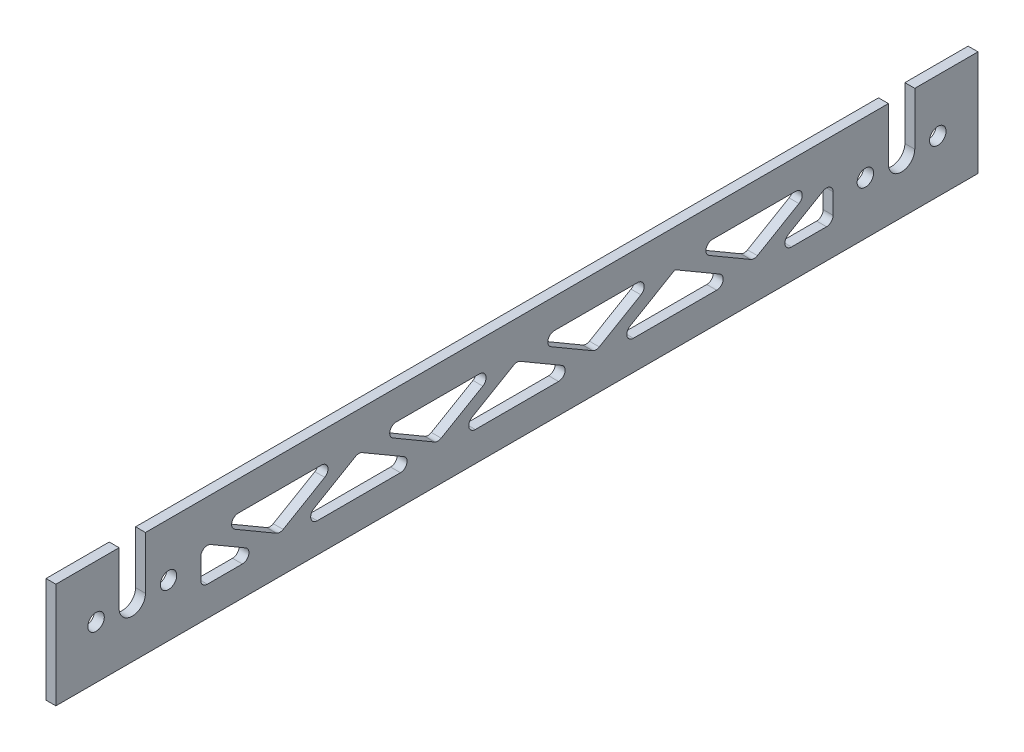
from build123d import *

# Parameters (mm, degrees)
SKETCH1_R           = 1.05
BOSS_EXTRUDE1_DEPTH = 1.5
FILLET1_R           = 1.5
SKETCH2_R           = 1.05
SKETCH2_W           = 4
SKETCH2_H           = 16
BOSS_EXTRUDE2_DEPTH = 1.5
SKETCH4_R           = 1.25
CUT_EXTRUDE2_DEPTH  = 160.067595694
CUT_EXTRUDE4_DEPTH  = 160.067595694
FILLET3_R           = 1
FILLET4_R           = 1.5
SKETCH6_W           = 140
SKETCH6_H           = 59.5
CUT_EXTRUDE5_DEPTH  = 10


with BuildPart() as part:
    # Sketch1 → Boss-Extrude1 (new body)
    with BuildSketch(Plane(origin=(0, 0, 0), x_dir=(0, 0, -1), z_dir=(1, 0, 0))):
        Polygon((0, 0), (0, 75.5), (21.5, 75.5), (40, 0), (35.881667859, 0), (29.755840045, 25), (4, 25), (4, 0), align=None)
        with Locations((5.5, 72.5)):
            Circle(SKETCH1_R, mode=Mode.SUBTRACT)
        with Locations((18.5, 72.5)):
            Circle(SKETCH1_R, mode=Mode.SUBTRACT)
        Polygon((4, 69.5), (18.851866535, 69.5), (4, 29), align=None, mode=Mode.SUBTRACT)
        Polygon((8.260475549, 29), (20.558388216, 62.535546651), (28.775707595, 29), align=None, mode=Mode.SUBTRACT)
    extrude(amount=BOSS_EXTRUDE1_DEPTH)

    # Fillet1
    fillet1_edges = [part.edges().sort_by_distance(p)[0] for p in [
        (0.75, 75.5, -21.5),
        (0.75, 25, -29.755840045),
        (0.75, 25, -4),
        (0.75, 69.5, -4),
        (0.75, 29, -4),
        (0.75, 69.5, -18.851866535),
        (0.75, 29, -8.260475549),
        (0.75, 29, -28.775707595),
        (0.75, 62.535546651, -20.558388216),
    ]]
    fillet(fillet1_edges, radius=FILLET1_R)

    # Sketch2 → Boss-Extrude2 (add)
    # profile 1 of 5: a face of its own
    with BuildSketch(Plane(origin=(1.5, 0, 0), x_dir=(0, 0, -1), z_dir=(1, 0, 0))):
        Polygon((70, 0), (70, 16), (36.079470199, 16), (40, 0), align=None)
    # profile 2 of 5: a face of its own
    with BuildSketch(Plane(origin=(1.5, 0, 0), x_dir=(0, 0, -1), z_dir=(1, 0, 0))):
        with BuildLine():
            Line((103.920529801, 16), (70, 16))
            Line((70, 16), (70, 0))
            Line((70, 0), (140, 0))
            Line((140, 0), (140, 16))
            Line((140, 16), (140, 75.5))
            Line((140, 75.5), (119.676824884, 75.5))
            ThreePointArc((119.676824884, 75.5), (118.750942408, 75.180144754), (118.219924421, 74.356988855))
            Line((118.219924421, 74.356988855), (103.920529801, 16))
        make_face()
        with BuildLine():
            Line((108.038861942, 16), (109.964084377, 23.856988855))
            ThreePointArc((109.964084377, 23.856988855), (110.495102363, 24.680144754), (111.420984839, 25))
            Line((111.420984839, 25), (134.5, 25))
            ThreePointArc((134.5, 25), (135.560660172, 24.560660172), (136, 23.5))
            Line((136, 23.5), (136, 16))
            Line((136, 16), (108.038861942, 16))
        make_face(mode=Mode.SUBTRACT)
        with BuildLine():
            ThreePointArc((131.000070484, 31.016439186), (130.821545012, 29.641122471), (129.591776989, 29))
            Line((129.591776989, 29), (113.136216627, 29))
            ThreePointArc((113.136216627, 29), (111.956071873, 29.574117524), (111.679316165, 30.856988855))
            Line((111.679316165, 30.856988855), (118.270545293, 57.756329353))
            ThreePointArc((118.270545293, 57.756329353), (119.644098522, 58.897023121), (121.135739251, 57.915779684))
            Line((121.135739251, 57.915779684), (131.000070484, 31.016439186))
        make_face(mode=Mode.SUBTRACT)
        with BuildLine():
            ThreePointArc((121.887587432, 67.483560814), (122.066112904, 68.858877529), (123.295880927, 69.5))
            Line((123.295880927, 69.5), (134.5, 69.5))
            ThreePointArc((134.5, 69.5), (135.560660172, 69.060660172), (136, 68))
            Line((136, 68), (136, 37.447151885))
            ThreePointArc((136, 37.447151885), (134.762259183, 35.970256452), (133.091706505, 36.930712699))
            Line((133.091706505, 36.930712699), (121.887587432, 67.483560814))
        make_face(mode=Mode.SUBTRACT)
        with Locations((121.5, 72.5)):
            Circle(SKETCH2_R, mode=Mode.SUBTRACT)
        with Locations((134.5, 72.5)):
            Circle(SKETCH2_R, mode=Mode.SUBTRACT)
    # profile 3 of 5: a face of its own
    with BuildSketch(Plane(origin=(1.5, 0, 0), x_dir=(0, 0, -1), z_dir=(1, 0, 0))):
        Polygon((35.881667859, 0), (31.961138058, 16), (4, 16), (4, 0), align=None)
    # profile 4 of 5: a face of its own
    with BuildSketch(Plane(origin=(1.5, 0, 0), x_dir=(0, 0, -1), z_dir=(1, 0, 0))):
        Polygon((40, 0), (36.079470199, 16), (31.961138058, 16), (35.881667859, 0), align=None)
    # profile 5 of 5: a face of its own
    with BuildSketch(Plane(origin=(1.5, 0, 0), x_dir=(0, 0, -1), z_dir=(1, 0, 0))):
        with Locations((2, 8)):
            Rectangle(SKETCH2_W, SKETCH2_H)
    extrude(amount=-BOSS_EXTRUDE2_DEPTH)

    # Sketch4 → Cut-Extrude2 (cut, through all)
    with BuildSketch(Plane(origin=(1.5, 0, 0), x_dir=(0, 0, -1), z_dir=(1, 0, 0))):
        with Locations((6.1, 8)):
            Circle(SKETCH4_R)
        with Locations((17.1, 8)):
            Circle(SKETCH4_R)
        with Locations(Location((122.9, 8, 0), (0, 0, 180))):
            Circle(SKETCH4_R)
        with Locations(Location((133.9, 8, 0), (0, 0, 180))):
            Circle(SKETCH4_R)
        with BuildLine():
            Line((126.4, 16), (130.4, 16))
            Line((130.4, 16), (130.4, 8))
            ThreePointArc((130.4, 8), (128.4, 6), (126.4, 8))
            Line((126.4, 8), (126.4, 16))
        make_face()
        with BuildLine():
            Line((9.6, 16), (13.6, 16))
            Line((13.6, 16), (13.6, 8))
            ThreePointArc((13.6, 8), (11.6, 6), (9.6, 8))
            Line((9.6, 8), (9.6, 16))
        make_face()
    extrude(amount=-CUT_EXTRUDE2_DEPTH, mode=Mode.SUBTRACT)

    # Sketch5 → Cut-Extrude4 (cut, through all)
    with BuildSketch(Plane(origin=(1.5, 0, 0), x_dir=(0, 0, -1), z_dir=(1, 0, 0))):
        Polygon((35.984634856, 4.5), (46, 4.5), (56.015365144, 4.5), (46, 10.342296334), align=None)
        Polygon((47.984634856, 11.5), (68.015365144, 11.5), (58, 5.657703666), align=None)
        Polygon((59.984634856, 4.5), (70, 4.5), (80.015365144, 4.5), (70, 10.342296334), align=None)
        Polygon((22, 4.5), (22, 10.342296334), (32.015365144, 4.5), align=None)
        Polygon((23.984634856, 11.5), (44.015365144, 11.5), (34, 5.657703666), align=None)
        Polygon((118, 4.5), (118, 10.342296334), (107.984634856, 4.5), align=None)
        Polygon((94, 4.5), (104.015365144, 4.5), (94, 10.342296334), (83.984634856, 4.5), align=None)
        Polygon((95.984634856, 11.5), (116.015365144, 11.5), (106, 5.657703666), align=None)
        Polygon((71.984634856, 11.5), (92.015365144, 11.5), (82, 5.657703666), align=None)
    extrude(amount=-CUT_EXTRUDE4_DEPTH, mode=Mode.SUBTRACT)

    # Fillet3
    fillet3_edges = [part.edges().sort_by_distance(p)[0] for p in [
        (0.75, 4.5, -83.984634856),
        (0.75, 4.5, -104.015365144),
        (0.75, 4.5, -80.015365144),
        (0.75, 4.5, -59.984634856),
        (0.75, 10.342296334, -70),
        (0.75, 4.5, -56.015365144),
        (0.75, 4.5, -35.984634856),
        (0.75, 10.342296334, -46),
        (0.75, 4.5, -118),
        (0.75, 4.5, -107.984634856),
        (0.75, 10.342296334, -118),
        (0.75, 11.5, -44.015365144),
        (0.75, 5.657703666, -34),
        (0.75, 11.5, -23.984634856),
        (0.75, 5.657703666, -58),
        (0.75, 11.5, -47.984634856),
        (0.75, 11.5, -68.015365144),
        (0.75, 11.5, -116.015365144),
        (0.75, 5.657703666, -106),
        (0.75, 11.5, -95.984634856),
        (0.75, 11.5, -92.015365144),
        (0.75, 5.657703666, -82),
        (0.75, 11.5, -71.984634856),
        (0.75, 4.5, -32.015365144),
        (0.75, 4.5, -22),
        (0.75, 10.342296334, -22),
    ]]
    fillet(fillet3_edges, radius=FILLET3_R)

    # Fillet4
    fillet4_edges = [part.edges().sort_by_distance(p)[0] for p in [
        (0.75, 16, -4),
        (0.75, 16, -31.961138058),
        (0.75, 16, -36.079470199),
        (0.75, 16, -136),
        (0.75, 16, -108.038861942),
        (0.75, 16, -103.920529801),
    ]]
    fillet(fillet4_edges, radius=FILLET4_R)

    # Sketch6 → Cut-Extrude5 (cut)
    with BuildSketch(Plane(origin=(1.5, 0, 0), x_dir=(0, 0, -1), z_dir=(1, 0, 0))):
        with Locations((70, 45.75)):
            Rectangle(SKETCH6_W, SKETCH6_H)
    extrude(amount=-CUT_EXTRUDE5_DEPTH, mode=Mode.SUBTRACT)


solid = part.part
